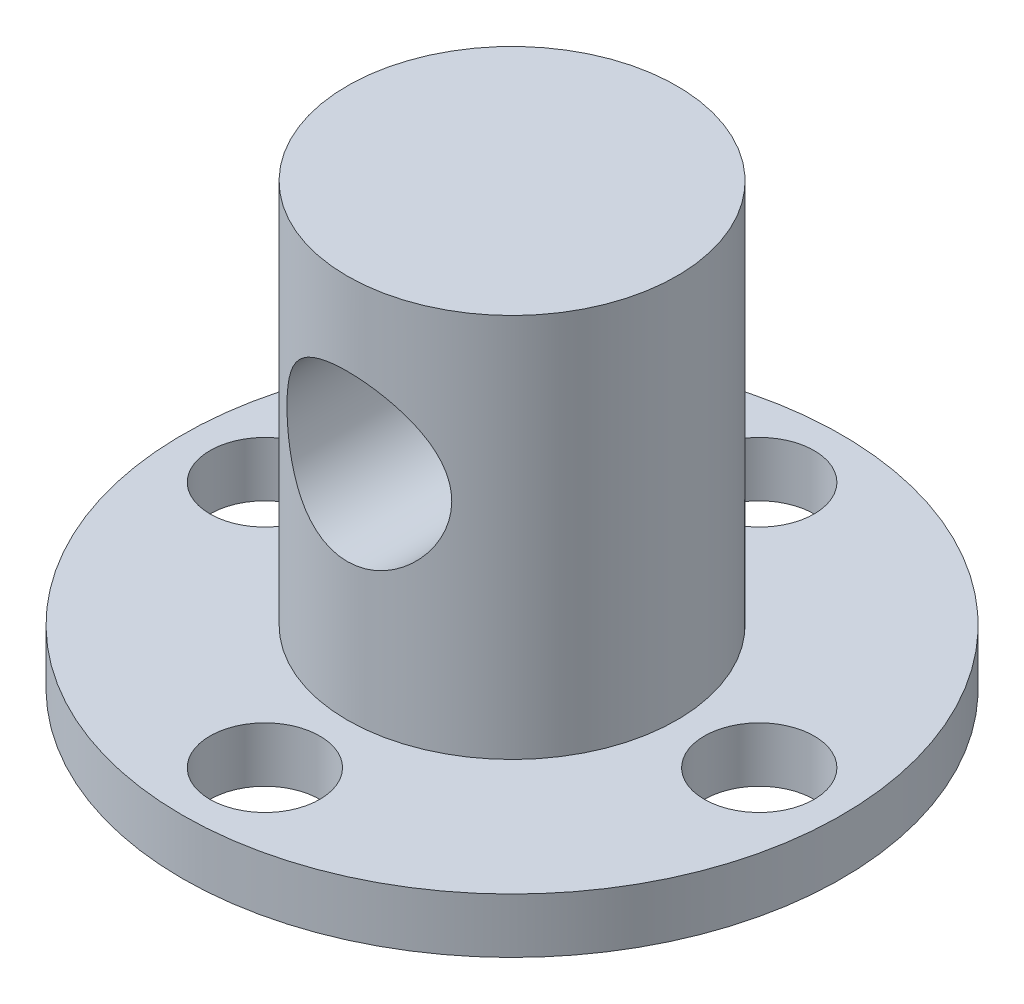
from build123d import *

# Parameters (mm, degrees)
SKETCH1_R           = 30
BOSS_EXTRUDE1_DEPTH = 5
SKETCH2_R           = 5
CUT_EXTRUDE1_DEPTH  = 5
SKETCH3_R           = 15
BOSS_EXTRUDE2_DEPTH = 35
SKETCH4_R           = 7.5
CUT_EXTRUDE2_DEPTH  = 68.268120235


with BuildPart() as part:
    # Sketch1 → Boss-Extrude1 (new body)
    with BuildSketch(Plane(origin=(0, 0, 0), x_dir=(1, 0, 0), z_dir=(0, 1, 0))):
        with Locations(Location((0, 0, 0), (0, 0, 270))):
            Circle(SKETCH1_R)
    extrude(amount=BOSS_EXTRUDE1_DEPTH)

    # Sketch2 → Cut-Extrude1 (cut)
    with BuildSketch(Plane(origin=(0, 5, 0), x_dir=(1, 0, 0), z_dir=(0, 1, 0))):
        with Locations(Location((0, 22.5, 0), (0, 0, 270))):
            Circle(SKETCH2_R)
        with Locations(Location((22.5, 0, 0), (0, 0, 270))):
            Circle(SKETCH2_R)
        with Locations(Location((0, -22.5, 0), (0, 0, 270))):
            Circle(SKETCH2_R)
        with Locations(Location((-22.5, 0, 0), (0, 0, 270))):
            Circle(SKETCH2_R)
    extrude(amount=-CUT_EXTRUDE1_DEPTH, mode=Mode.SUBTRACT)

    # Sketch3 → Boss-Extrude2 (add)
    with BuildSketch(Plane(origin=(0, 5, 0), x_dir=(1, 0, 0), z_dir=(0, 1, 0))):
        with Locations(Location((0, 0, 0), (0, 0, 270))):
            Circle(SKETCH3_R)
    extrude(amount=BOSS_EXTRUDE2_DEPTH)

    # Sketch4 → Cut-Extrude2 (cut, through all)
    with BuildSketch(Plane.XY.offset(15)):
        with Locations(Location((0, 25, 0), (0, 0, 90.000000014))):
            Circle(SKETCH4_R)
    extrude(amount=-CUT_EXTRUDE2_DEPTH, mode=Mode.SUBTRACT)


solid = part.part
